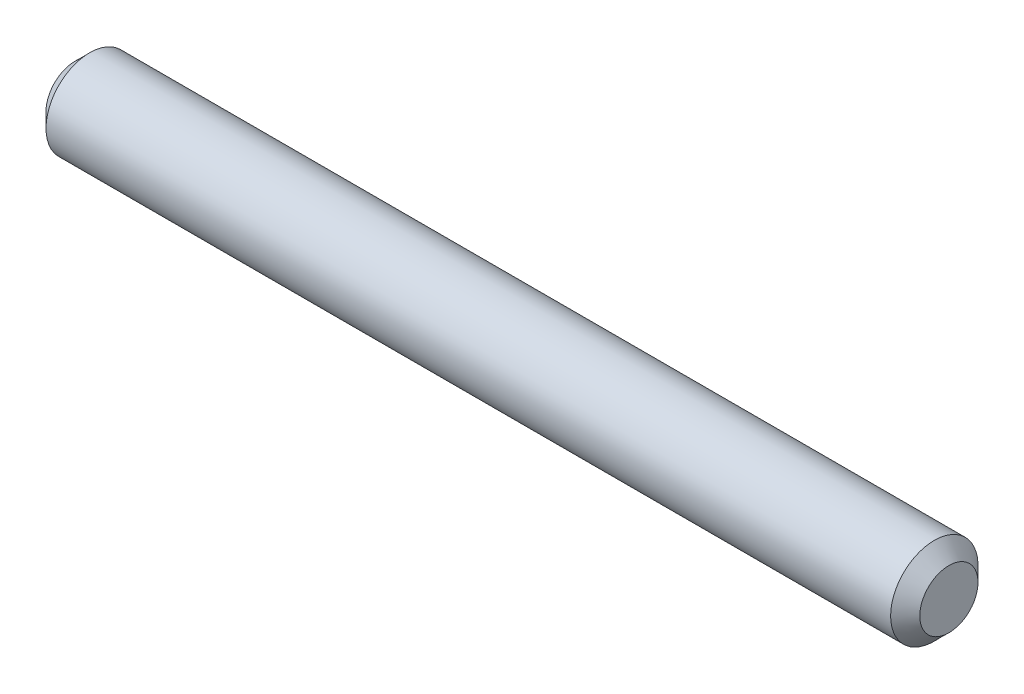
from build123d import *


with BuildPart() as part:
    # Sketch1 → Revolve1 (revolve)
    with BuildSketch(Plane.XY, mode=Mode.PRIVATE) as revolve1_sk:
        Polygon((1.5, 0), (1.5, 1), (2, 1.5), (31, 1.5), (31.5, 1), (31.5, 0), align=None)
    revolve(revolve1_sk.sketch.rotate(Axis((0, 0, 0), (1, 0, 0)), 90), axis=Axis((0, 0, 0), (1, 0, 0)))


solid = part.part
